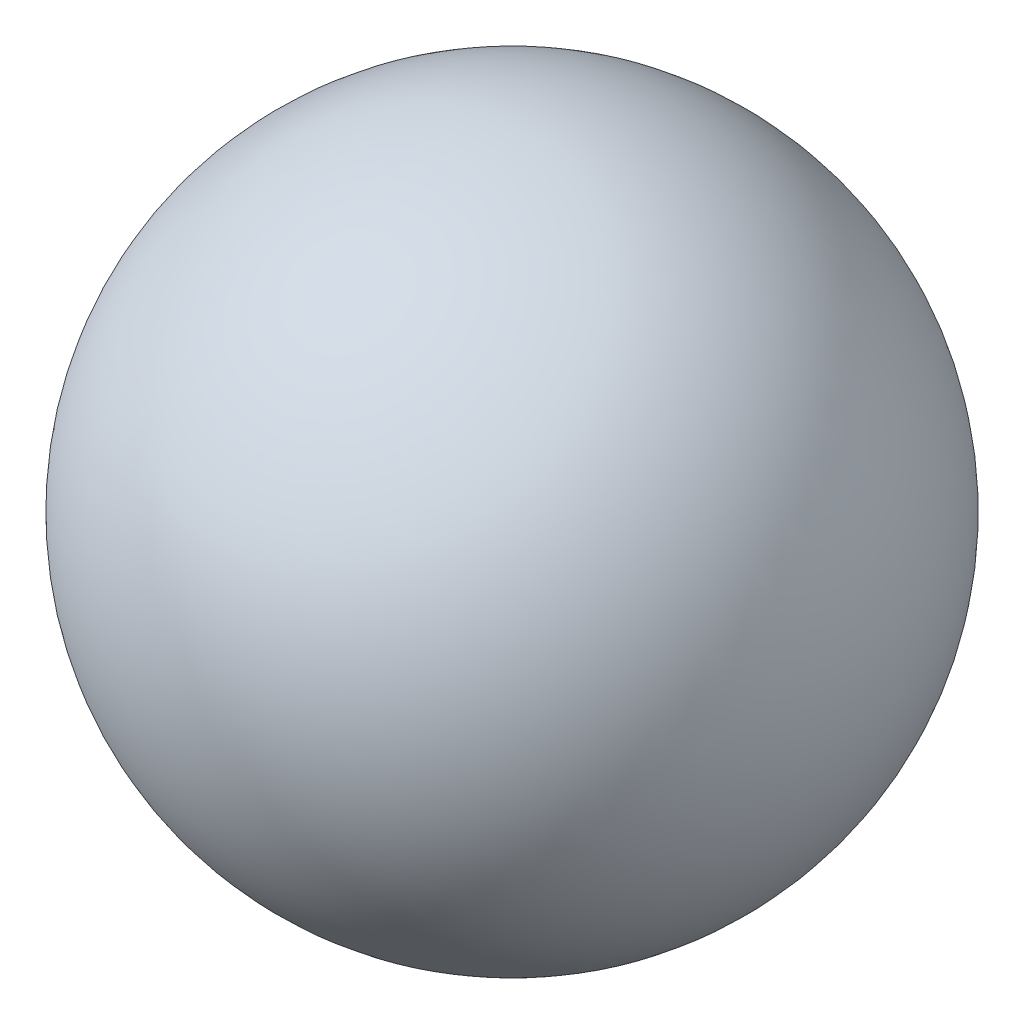
from build123d import *


with BuildPart() as part:
    # Sketch1 → Revolve1 (revolve)
    with BuildSketch(Plane.XY):
        with BuildLine():
            Line((0, 4.7625), (0, -4.7625))
            ThreePointArc((0, -4.7625), (4.7625, 0), (0, 4.7625))
        make_face()
    revolve(axis=Axis((0, 4.7625, 0), (0, -1, 0)))


solid = part.part
